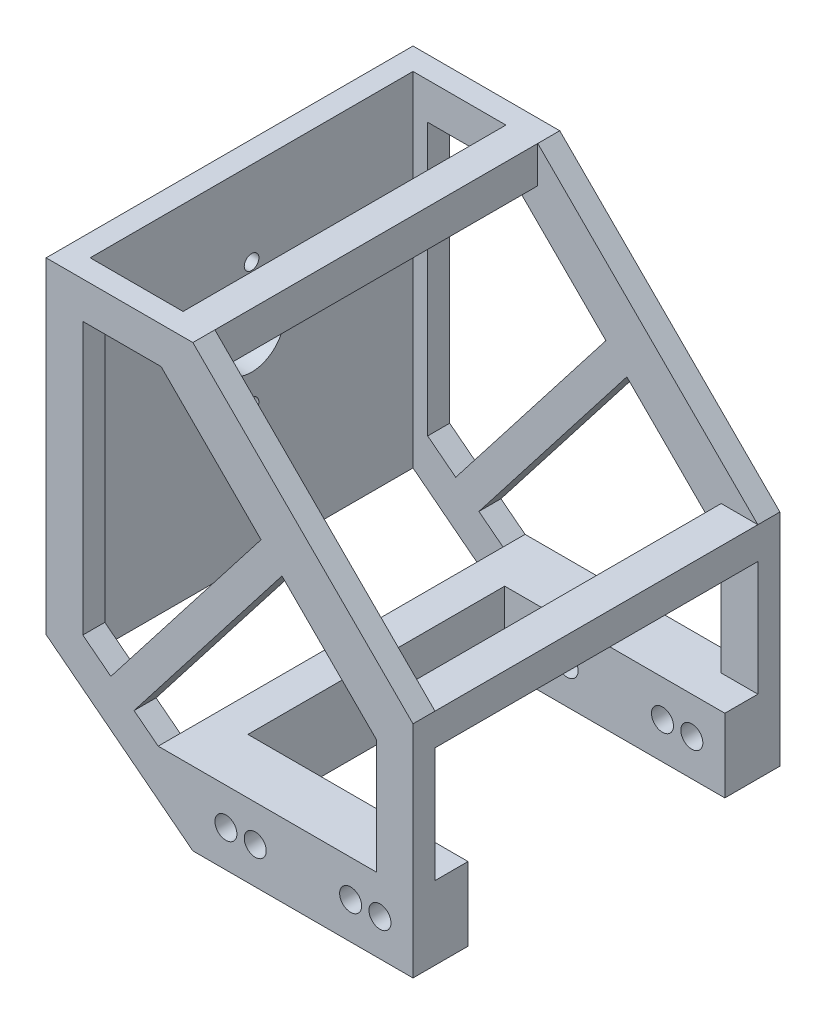
from build123d import *

# Parameters (mm, degrees)
SKETCH2_W           = 50
SKETCH2_H           = 60
BOSS_EXTRUDE1_DEPTH = 25
SHELL1_T            = -3
SKETCH3_R           = 11
BOSS_EXTRUDE2_DEPTH = 3
SKETCH4_R           = 4.5
SKETCH4_R_2         = 1
CUT_EXTRUDE1_DEPTH  = 6
CUT_EXTRUDE2_REACH  = 83.24
CUT_EXTRUDE4_REACH  = 83.24
SKETCH7_W           = 4.336684694
SKETCH7_H           = 5
SKETCH7_W_2         = 5
SKETCH7_H_2         = 4.336684694
BOSS_EXTRUDE3_DEPTH = 44
BOSS_EXTRUDE4_REACH = 73.148
SKETCH8_W           = 4
SKETCH8_H           = 3
SKETCH10_W          = 30
SKETCH10_H          = 10
BOSS_EXTRUDE5_DEPTH = 4.5
CUT_EXTRUDE5_START  = -50
SKETCH9_R           = 1.5
CUT_EXTRUDE5_DEPTH  = 50


with BuildPart() as part:
    # Sketch2 → Boss-Extrude1 (new, symmetric)
    with BuildSketch(Plane.XY):
        with Locations((25, -10)):
            Rectangle(SKETCH2_W, SKETCH2_H)
    extrude(amount=BOSS_EXTRUDE1_DEPTH, both=True)

    # Shell1
    shell1_openings = [part.faces().sort_by_distance(p)[0] for p in [
        (25, 20, 0),
        (50, -10, 0),
        (25, -40, 0),
    ]]
    offset(amount=SHELL1_T, openings=shell1_openings, kind=Kind.INTERSECTION)

    # Sketch3 → Boss-Extrude2 (add)
    with BuildSketch(Plane.ZY):
        with Locations(Location((0, 0, 0), (0, 0, 270))):
            Circle(SKETCH3_R)
    extrude(amount=BOSS_EXTRUDE2_DEPTH)

    # Sketch4 → Cut-Extrude1 (cut)
    with BuildSketch(Plane.ZY.offset(3)):
        with Locations(Location((0, 0, 0), (0, 0, 270))):
            Circle(SKETCH4_R)
        with Locations(Location((-8.5, 0, 0), (0, 0, 270))):
            Circle(SKETCH4_R_2)
        with Locations(Location((0, 8.5, 0), (0, 0, 270))):
            Circle(SKETCH4_R_2)
        with Locations(Location((8.5, 0, 0), (0, 0, 270))):
            Circle(SKETCH4_R_2)
        with Locations(Location((0, -8.5, 0), (0, 0, 270))):
            Circle(SKETCH4_R_2)
    extrude(amount=-CUT_EXTRUDE1_DEPTH, mode=Mode.SUBTRACT)

    # Cut-Extrude2: up to this face of the body (flat: up to its plane)
    cut_extrude2_end = Plane(part.part.faces().sort_by_distance((25, -10, -25))[0])
    # Sketch5 → Cut-Extrude2 (cut, up to the picked face)
    with BuildSketch(Plane.XY.offset(25), mode=Mode.PRIVATE) as cut_extrude2_sk1:
        Polygon((0, -24.472587055), (0, -40), (20, -40), align=None)
    cut_extrude2_tool1 = split(extrude(cut_extrude2_sk1.sketch, amount=-CUT_EXTRUDE2_REACH, mode=Mode.PRIVATE), bisect_by=cut_extrude2_end, keep=Keep.BOTH, mode=Mode.PRIVATE)
    # Sketch5 → Cut-Extrude2 (cut, up to the picked face)
    with BuildSketch(Plane.XY.offset(25), mode=Mode.PRIVATE) as cut_extrude2_sk2:
        Polygon((20, 20), (50, -10), (50, 20), align=None)
    cut_extrude2_tool2 = split(extrude(cut_extrude2_sk2.sketch, amount=-CUT_EXTRUDE2_REACH, mode=Mode.PRIVATE), bisect_by=cut_extrude2_end, keep=Keep.BOTH, mode=Mode.PRIVATE)
    add(cut_extrude2_tool1.solids().sort_by(Axis((6.666667, -34.824196, 25), (0, 0, -1)))[0], mode=Mode.SUBTRACT)
    add(cut_extrude2_tool2.solids().sort_by(Axis((40, 10, 25), (0, 0, -1)))[0], mode=Mode.SUBTRACT)

    # Cut-Extrude4: up to this face of the body (flat: up to its plane)
    cut_extrude4_end = Plane(part.part.faces().sort_by_distance((23.370039897, -12.148657051, -25))[0])
    # Sketch6 → Cut-Extrude4 (cut, up to the picked face)
    with BuildSketch(Plane.XY.offset(25), mode=Mode.PRIVATE) as cut_extrude4_sk1:
        Polygon((5, 15), (15.663315306, 15), (45, -14.336684694), (45, -30), (15.272864665, -30), (5, -22.024449411), align=None)
    cut_extrude4_tool1 = split(extrude(cut_extrude4_sk1.sketch, amount=-CUT_EXTRUDE4_REACH, mode=Mode.PRIVATE), bisect_by=cut_extrude4_end, keep=Keep.BOTH, mode=Mode.PRIVATE)
    add(cut_extrude4_tool1.solids().sort_by(Axis((22.200817, -11.008152, 25), (0, 0, -1)))[0], mode=Mode.SUBTRACT)

    # Sketch7 → Boss-Extrude3 (add)
    with BuildSketch(Plane(origin=(0, 0, 22), x_dir=(-1, 0, 0), z_dir=(0, 0, -1))):
        with Locations((-17.831657653, 17.5)):
            Rectangle(SKETCH7_W, SKETCH7_H)
        with Locations((-47.5, -12.168342347)):
            Rectangle(SKETCH7_W_2, SKETCH7_H_2)
        Polygon((-15.272864665, -30), (-20, -30), (-20, -40), (-15.272864665, -36.32999088), align=None)
    extrude(amount=BOSS_EXTRUDE3_DEPTH)

    # Boss-Extrude4: up to this plane
    boss_extrude4_end = Plane(origin=(15.663315306, 15, -85.207972894), z_dir=(0.7071067811865476, 0.7071067811865476, 0))
    # Sketch8 → Boss-Extrude4 (add, up to the surface)
    with BuildSketch(Plane(origin=(-8.788249565, -11.319657172, 0), x_dir=(0.789890553461427, -0.6132478402345992, 0), z_dir=(0.6132478402345992, 0.789890553461427, 0)), mode=Mode.PRIVATE) as boss_extrude4_sk1:
        with Locations((24.294868458, 23.5)):
            Rectangle(SKETCH8_W, SKETCH8_H)
    boss_extrude4_tool1 = split(extrude(boss_extrude4_sk1.sketch, amount=BOSS_EXTRUDE4_REACH, mode=Mode.PRIVATE), bisect_by=boss_extrude4_end, keep=Keep.BOTH, mode=Mode.PRIVATE)
    add(boss_extrude4_tool1.solids().sort_by_distance((10.402038, -26.218433, -23.5))[0])
    # Sketch8 → Boss-Extrude4 (add, up to the surface)
    with BuildSketch(Plane(origin=(-8.788249565, -11.319657172, 0), x_dir=(0.789890553461427, -0.6132478402345992, 0), z_dir=(0.6132478402345992, 0.789890553461427, 0)), mode=Mode.PRIVATE) as boss_extrude4_sk2:
        with Locations((24.294868458, -23.5)):
            Rectangle(SKETCH8_W, SKETCH8_H)
    boss_extrude4_tool2 = split(extrude(boss_extrude4_sk2.sketch, amount=BOSS_EXTRUDE4_REACH, mode=Mode.PRIVATE), bisect_by=boss_extrude4_end, keep=Keep.BOTH, mode=Mode.PRIVATE)
    add(boss_extrude4_tool2.solids().sort_by_distance((10.402038, -26.218433, 23.5))[0])

    # Sketch10 → Boss-Extrude5 (add)
    with BuildSketch(Plane.XY.offset(-22)):
        with Locations((35, -35)):
            Rectangle(SKETCH10_W, SKETCH10_H)
    boss_extrude5 = extrude(amount=BOSS_EXTRUDE5_DEPTH)

    # Mirror1: Boss-Extrude5 across plane
    add(boss_extrude5.mirror(Plane.XY))

    # Sketch9 → Cut-Extrude5 (cut)
    with BuildSketch(Plane.XY.offset(25).offset(CUT_EXTRUDE5_START)):
        with Locations((24.5, -35)):
            Circle(SKETCH9_R)
        with Locations((28.5, -35)):
            Circle(SKETCH9_R)
        with Locations((41.5, -35)):
            Circle(SKETCH9_R)
        with Locations((45.5, -35)):
            Circle(SKETCH9_R)
    extrude(amount=CUT_EXTRUDE5_DEPTH, mode=Mode.SUBTRACT)


solid = part.part
